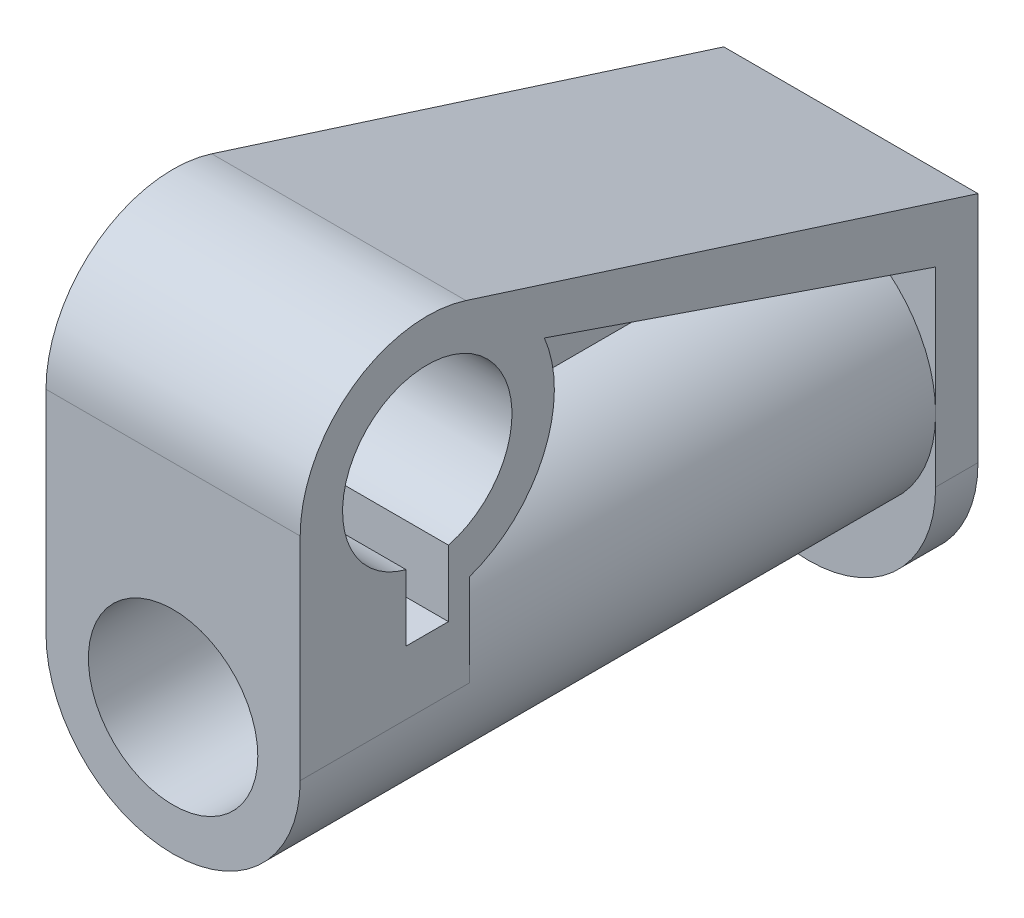
from build123d import *

# Parameters (mm, degrees)
SKETCH1_R            = 10
BOSS_EXTRUDE1_DEPTH  = 80
BOSS_EXTRUDE2_DEPTH  = 5
BOSS_EXTRUDE3_DEPTH  = 15
BOSS_EXTRUDE21_DEPTH = 2.5
CUT_EXTRUDE1_DEPTH   = 15
SKETCH1_4_R          = 10
CUT_EXTRUDE2_DEPTH   = 80


with BuildPart() as part:
    # Sketch1 → Boss-Extrude1 (new body)
    with BuildSketch(Plane.XY):
        with BuildLine():
            ThreePointArc((15, 0), (0, 15), (-15, 0))
            ThreePointArc((-15, 0), (0, -15), (15, 0))
        make_face()
        Circle(SKETCH1_R, mode=Mode.SUBTRACT)
    extrude(amount=BOSS_EXTRUDE1_DEPTH)

    # Sketch1<3> → Boss-Extrude2 (add)
    with BuildSketch(Plane.XY):
        with BuildLine():
            Line((-15, 0), (-15, -7.5))
            ThreePointArc((-15, -7.5), (0, -22.5), (15, -7.5))
            Line((15, -7.5), (15, 0))
            ThreePointArc((15, 0), (0, -15), (-15, 0))
        make_face()
    extrude(amount=BOSS_EXTRUDE2_DEPTH)

    # Sketch2 → Boss-Extrude3 (add, symmetric)
    with BuildSketch(Plane(origin=(0, 0, 0), x_dir=(0, 0, -1), z_dir=(1, 0, 0))):
        with BuildLine():
            ThreePointArc((-60.439243158, 39.289838943), (-73.848407975, 37.112211867), (-80, 25))
            Line((-80, 25), (-80, 0))
            Line((-80, 0), (-60, 0))
            Line((-60, 0), (-60, 10))
            Line((-60, 10), (-60, 10.857864376))
            ThreePointArc((-60, 10.857864376), (-51.277883135, 18.941657921), (-51.180759566, 30.83340328))
            Line((-51.180759566, 30.83340328), (-5, 15))
            Line((-5, 15), (-5, 10))
            Line((-5, 10), (-5, 0))
            Line((-5, 0), (0, 0))
            Line((0, 0), (0, 15))
            Line((0, 15), (0, 20))
            Line((0, 20), (-60.439243158, 39.289838943))
        make_face()
        with BuildLine():
            Line((-67.5, 7.5), (-67.5, 15.317541634))
            ThreePointArc((-67.5, 15.317541634), (-65, 35), (-62.5, 15.317541634))
            Line((-62.5, 15.317541634), (-62.5, 7.5))
            Line((-62.5, 7.5), (-67.5, 7.5))
        make_face(mode=Mode.SUBTRACT)
    extrude(amount=BOSS_EXTRUDE3_DEPTH, both=True)

    # Sketch2<8> → Boss-Extrude21 (add, symmetric)
    with BuildSketch(Plane(origin=(0, 0, 0), x_dir=(0, 0, -1), z_dir=(1, 0, 0))):
        with BuildLine():
            Line((-60, 10.857864376), (-60, 10))
            Line((-60, 10), (-5, 10))
            Line((-5, 10), (-5, 15))
            Line((-5, 15), (-51.180759566, 30.83340328))
            ThreePointArc((-51.180759566, 30.83340328), (-51.277883135, 18.941657921), (-60, 10.857864376))
        make_face()
    extrude(amount=BOSS_EXTRUDE21_DEPTH, both=True)

    # Sketch2<9> → Cut-Extrude1 (cut, symmetric)
    with BuildSketch(Plane(origin=(0, 0, 0), x_dir=(0, 0, -1), z_dir=(1, 0, 0))):
        with BuildLine():
            ThreePointArc((-62.5, 15.317541634), (-65, 35), (-67.5, 15.317541634))
            Line((-67.5, 15.317541634), (-67.5, 7.5))
            Line((-67.5, 7.5), (-62.5, 7.5))
            Line((-62.5, 7.5), (-62.5, 15.317541634))
        make_face()
    extrude(amount=CUT_EXTRUDE1_DEPTH, both=True, mode=Mode.SUBTRACT)

    # Sketch1<4> → Cut-Extrude2 (cut)
    with BuildSketch(Plane.XY):
        Circle(SKETCH1_4_R)
    extrude(amount=CUT_EXTRUDE2_DEPTH, mode=Mode.SUBTRACT)


solid = part.part
